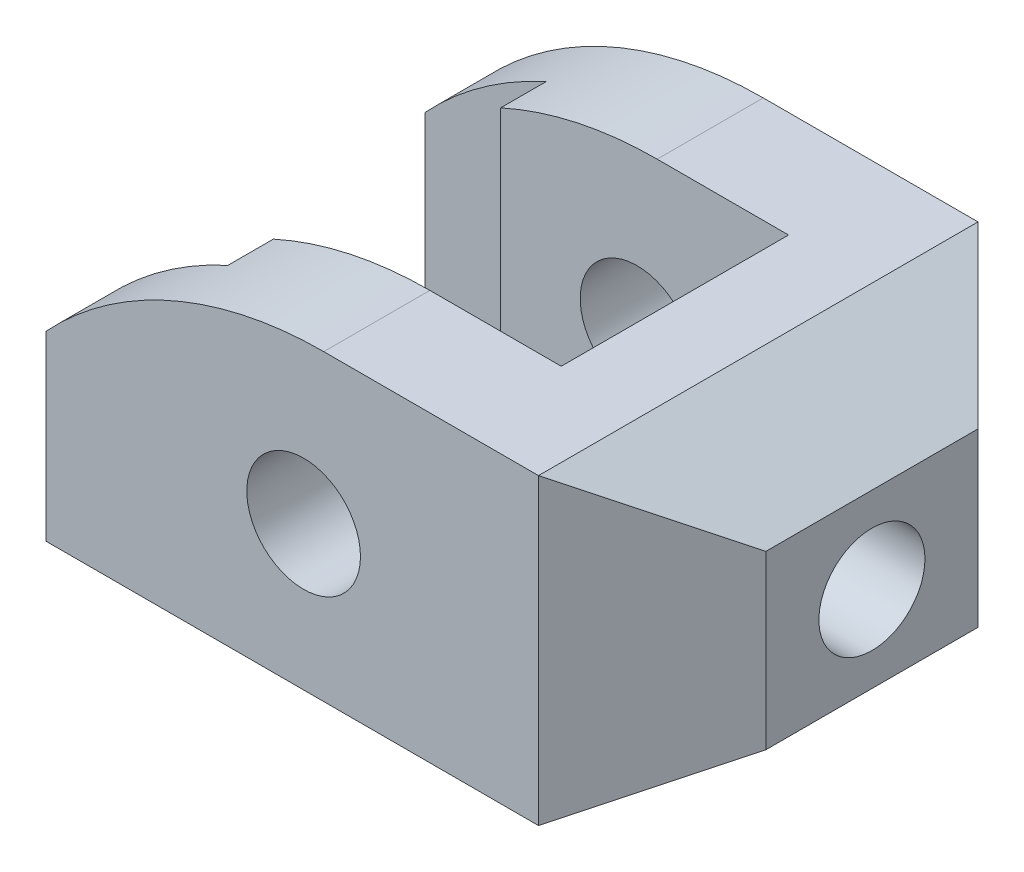
from build123d import *

# Parameters (mm, degrees)
SKETCH1_W           = 80
SKETCH1_H           = 58
BOSS_EXTRUDE1_DEPTH = 40
SKETCH2_R           = 7.5
CUT_EXTRUDE1_DEPTH  = 82.018516402
CUT_EXTRUDE6_DEPTH  = 64.568860301
SKETCH4_R           = 7
CUT_EXTRUDE7_DEPTH  = 95.026591983


with BuildPart() as part:
    # Sketch1 → Boss-Extrude1 (new body)
    with BuildSketch(Plane(origin=(0, 0, 0), x_dir=(1, 0, 0), z_dir=(0, 1, 0))):
        Rectangle(SKETCH1_W, SKETCH1_H)
    extrude(amount=BOSS_EXTRUDE1_DEPTH)

    # Sketch2 → Cut-Extrude1 (cut, through all)
    with BuildSketch(Plane.XY.offset(29)):
        Polygon((40, 40), (25, 40), (40, 31.339745962), align=None)
        with BuildLine():
            ThreePointArc((-40, 24), (-23.33939444, 35.82575695), (-3.33939444, 40))
            Line((-3.33939444, 40), (-40, 40))
            Line((-40, 40), (-40, 24))
        make_face()
        Polygon((40, 0), (40, 8.660254038), (25, 0), align=None)
        with Locations((-6, 19)):
            Circle(SKETCH2_R)
    extrude(amount=-CUT_EXTRUDE1_DEPTH, mode=Mode.SUBTRACT)

    # Sketch3 → Cut-Extrude6 (cut, through all)
    with BuildSketch(Plane(origin=(0, 0, 0), x_dir=(1, 0, 0), z_dir=(0, 1, 0))):
        Polygon((25, 29), (40, 29), (40, 14), align=None)
        Polygon((40, -14), (25, -29), (40, -29), align=None)
        Polygon((-40, 21), (-24, 21), (-24, 15), (14, 15), (14, -15), (-24, -15), (-24, -21), (-40, -21), align=None)
    extrude(amount=CUT_EXTRUDE6_DEPTH, mode=Mode.SUBTRACT)

    # Sketch4 → Cut-Extrude7 (cut, through all)
    with BuildSketch(Plane(origin=(40, 0, 0), x_dir=(0, 0, -1), z_dir=(1, 0, 0))):
        with Locations((0, 20)):
            Circle(SKETCH4_R)
    extrude(amount=-CUT_EXTRUDE7_DEPTH, mode=Mode.SUBTRACT)


solid = part.part
